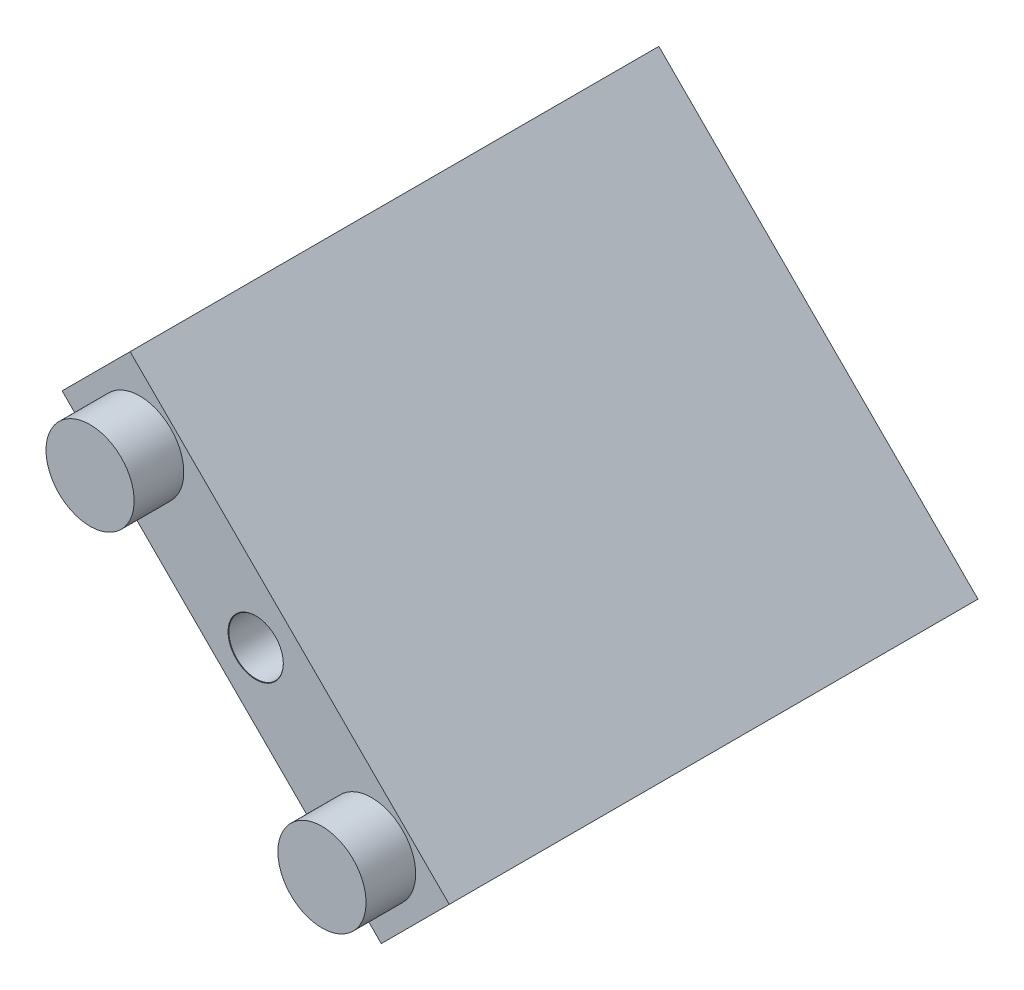
from build123d import *

# Parameters (mm, degrees)
BOSS_EXTRUDE1_DEPTH            = 33
SKETCH2_R                      = 2.75
BOSS_EXTRUDE2_DEPTH            = 3.1
M3_CLEARANCE_HOLE1_D           = 3.4
M3_CLEARANCE_HOLE1_DEPTH       = 3
M3_CLEARANCE_HOLE1_CSINK_D     = 3.45
M3_CLEARANCE_HOLE1_CSINK_ANGLE = 90
M3_CLEARANCE_HOLE1_TIP         = 1.021463052


with BuildPart() as part:
    # Sketch1 → Boss-Extrude1 (new body)
    with BuildSketch(Plane.XY):
        Polygon((17.123869681, -2.982979073), (21.366510368, 1.259661614), (1.447312342, 21.17885964), (-2.795328345, 16.936218953), align=None)
    extrude(amount=BOSS_EXTRUDE1_DEPTH)

    # Sketch2 → Boss-Extrude2 (add)
    with BuildSketch(Plane.XY.offset(33)):
        with Locations(Location((2.048353106, 16.335178189, 0), (0, 0, 180))):
            Circle(SKETCH2_R)
        with Locations(Location((16.522828917, 1.860702378, 0), (0, 0, 180))):
            Circle(SKETCH2_R)
    extrude(amount=BOSS_EXTRUDE2_DEPTH)

    # M3 Clearance Hole1
    with Locations(Plane.XY.offset(33)):
        with Locations((9.285591012, 9.097940284)):
            CounterSinkHole(M3_CLEARANCE_HOLE1_D / 2, M3_CLEARANCE_HOLE1_CSINK_D / 2, depth=M3_CLEARANCE_HOLE1_DEPTH, counter_sink_angle=M3_CLEARANCE_HOLE1_CSINK_ANGLE)
            with Locations((0, 0, -(M3_CLEARANCE_HOLE1_DEPTH + M3_CLEARANCE_HOLE1_TIP / 2))):  # 118° drill point
                Cone(0, M3_CLEARANCE_HOLE1_D / 2, M3_CLEARANCE_HOLE1_TIP, mode=Mode.SUBTRACT)


solid = part.part
